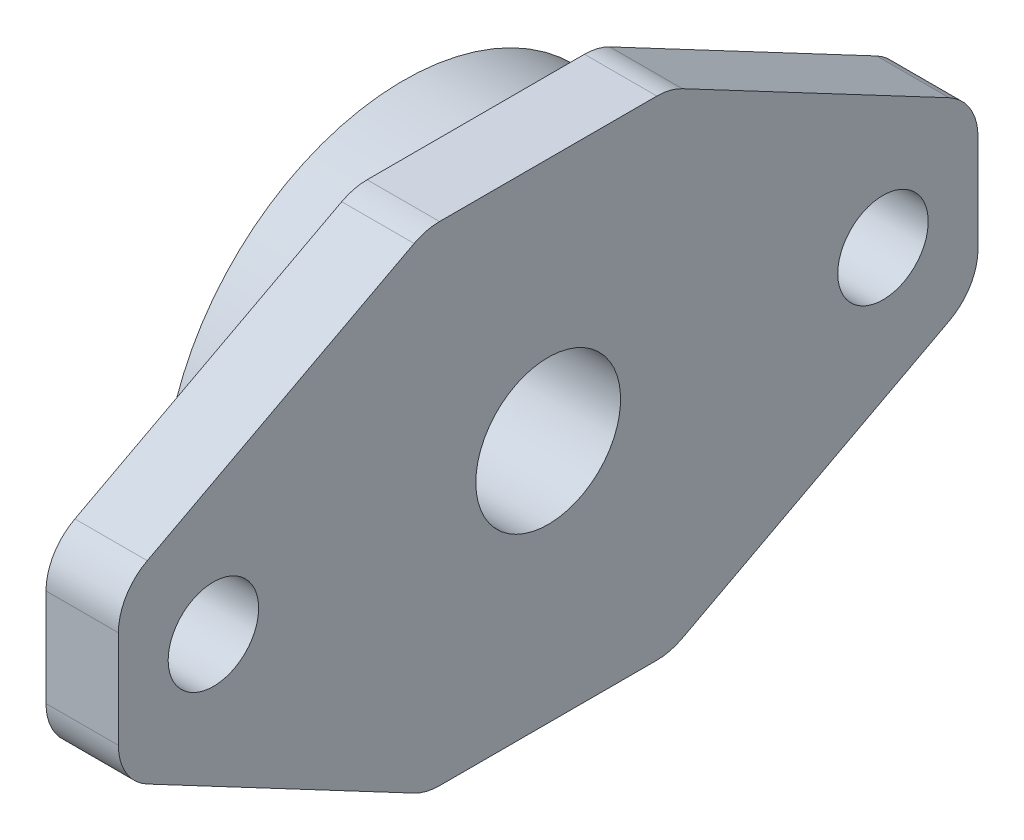
from build123d import *

# Parameters (mm, degrees)
SKETCH_1_W          = 47.5
SKETCH_1_H          = 27
EXTRUDE_1_DEPTH     = 4
SKETCH_5_R          = 13.25
EXTRUDE_2_DEPTH     = 4
SKETCH_6_R          = 6
EXTRUDE_3_DEPTH     = 3.5
SKETCH_7_R          = 4
CUT_EXTRUDE_1_DEPTH = 56.834577101
SKETCH_8_R          = 2.5
CUT_EXTRUDE_2_DEPTH = 56.149796011
CUT_EXTRUDE_3_DEPTH = 56.149796011
FILLET_1_R          = 3


with BuildPart() as part:
    # 草图1 → 凸台-拉伸1 (new body)
    with BuildSketch(Plane(origin=(0, 0, 0), x_dir=(0, 0, -1), z_dir=(1, 0, 0))):
        with Locations((23.75, 13.5)):
            Rectangle(SKETCH_1_W, SKETCH_1_H)
    extrude(amount=EXTRUDE_1_DEPTH)

    # 草图5 → 凸台-拉伸2 (add)
    with BuildSketch(Plane.ZY):
        with Locations((-23.75, 13.5)):
            Circle(SKETCH_5_R)
    extrude(amount=EXTRUDE_2_DEPTH)

    # 草图6 → 凸台-拉伸3 (add)
    with BuildSketch(Plane.ZY.offset(4)):
        with Locations((-23.75, 13.5)):
            Circle(SKETCH_6_R)
    extrude(amount=EXTRUDE_3_DEPTH)

    # 草图7 → 切除-拉伸1 (cut, through all)
    with BuildSketch(Plane.ZY.offset(7.5)):
        with Locations((-23.75, 13.5)):
            Circle(SKETCH_7_R)
    extrude(amount=-CUT_EXTRUDE_1_DEPTH, mode=Mode.SUBTRACT)

    # 草图8 → 切除-拉伸2 (cut, through all)
    with BuildSketch(Plane.ZY):
        with Locations((-42.25, 13.5)):
            Circle(SKETCH_8_R)
        with Locations((-5.25, 13.5)):
            Circle(SKETCH_8_R)
    extrude(amount=-CUT_EXTRUDE_2_DEPTH, mode=Mode.SUBTRACT)

    # 草图9 → 切除-拉伸3 (cut, through all)
    with BuildSketch(Plane.ZY):
        Polygon((-47.5, 9), (-30.5, 0), (-47.5, 0), align=None)
        Polygon((-47.5, 18), (-30.5, 27), (-47.5, 27), align=None)
        Polygon((0, 0), (-17, 0), (0, 9), align=None)
        Polygon((0, 18), (0, 27), (-17, 27), align=None)
    extrude(amount=-CUT_EXTRUDE_3_DEPTH, mode=Mode.SUBTRACT)

    # 圆角1
    fillet_1_edges = [part.edges().sort_by_distance(p)[0] for p in [
        (2, 9, -47.5),
        (2, 0, -30.5),
        (2, 18, -47.5),
        (2, 27, -30.5),
        (2, 9, 0),
        (2, 0, -17),
        (2, 18, 0),
        (2, 27, -17),
    ]]
    fillet(fillet_1_edges, radius=FILLET_1_R)


solid = part.part
